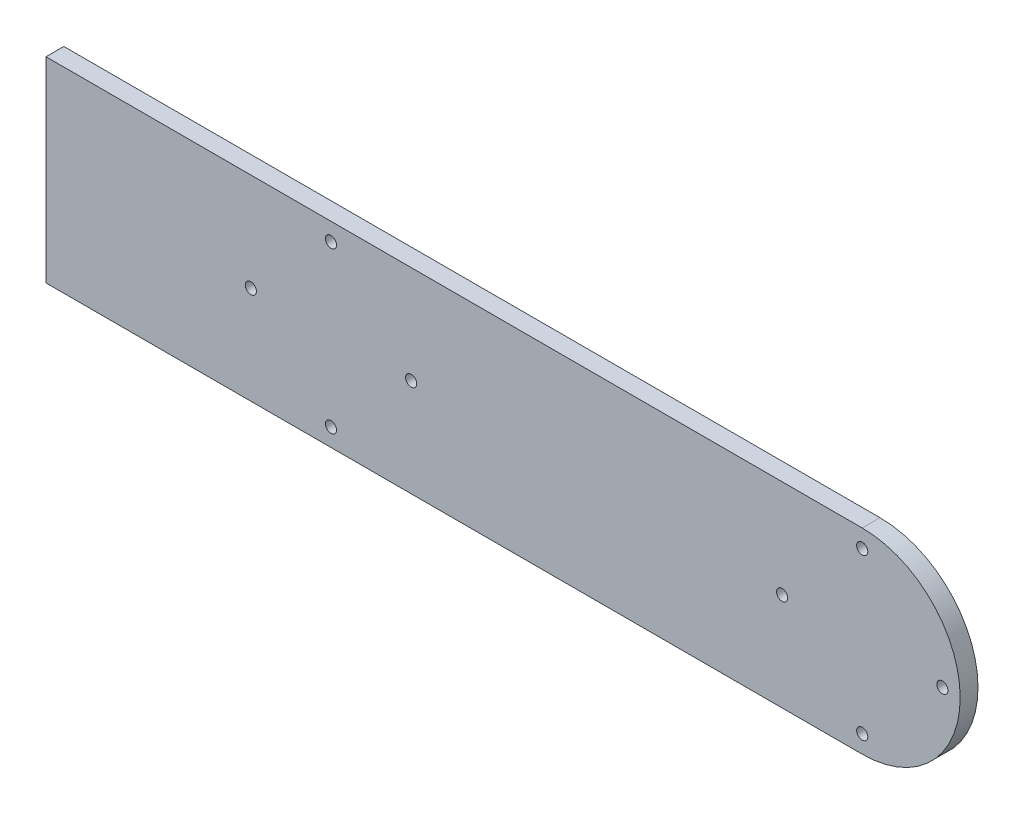
from build123d import *

# Parameters (mm, degrees)
SKETCH2_R           = 1.5635
BOSS_EXTRUDE1_DEPTH = 5


with BuildPart() as part:
    # Sketch2 → Boss-Extrude1 (new body)
    with BuildSketch(Plane.XY):
        with BuildLine():
            Line((0, 27.5), (-229.132053392, 27.5))
            Line((-229.132053392, 27.5), (-229.132053392, -27.5))
            Line((-229.132053392, -27.5), (0, -27.5))
            ThreePointArc((0, -27.5), (27.5, 0), (0, 27.5))
        make_face()
        with Locations((0, 22.5)):
            Circle(SKETCH2_R, mode=Mode.SUBTRACT)
        with Locations((22.5, 0)):
            Circle(SKETCH2_R, mode=Mode.SUBTRACT)
        with Locations((0, -22.5)):
            Circle(SKETCH2_R, mode=Mode.SUBTRACT)
        with Locations((-22.5, 0)):
            Circle(SKETCH2_R, mode=Mode.SUBTRACT)
        with Locations((-171.632053392, 0)):
            Circle(SKETCH2_R, mode=Mode.SUBTRACT)
        with Locations((-149.132053392, 22.5)):
            Circle(SKETCH2_R, mode=Mode.SUBTRACT)
        with Locations((-126.632053392, 0)):
            Circle(SKETCH2_R, mode=Mode.SUBTRACT)
        with Locations((-149.132053392, -22.5)):
            Circle(SKETCH2_R, mode=Mode.SUBTRACT)
    extrude(amount=BOSS_EXTRUDE1_DEPTH)


solid = part.part
